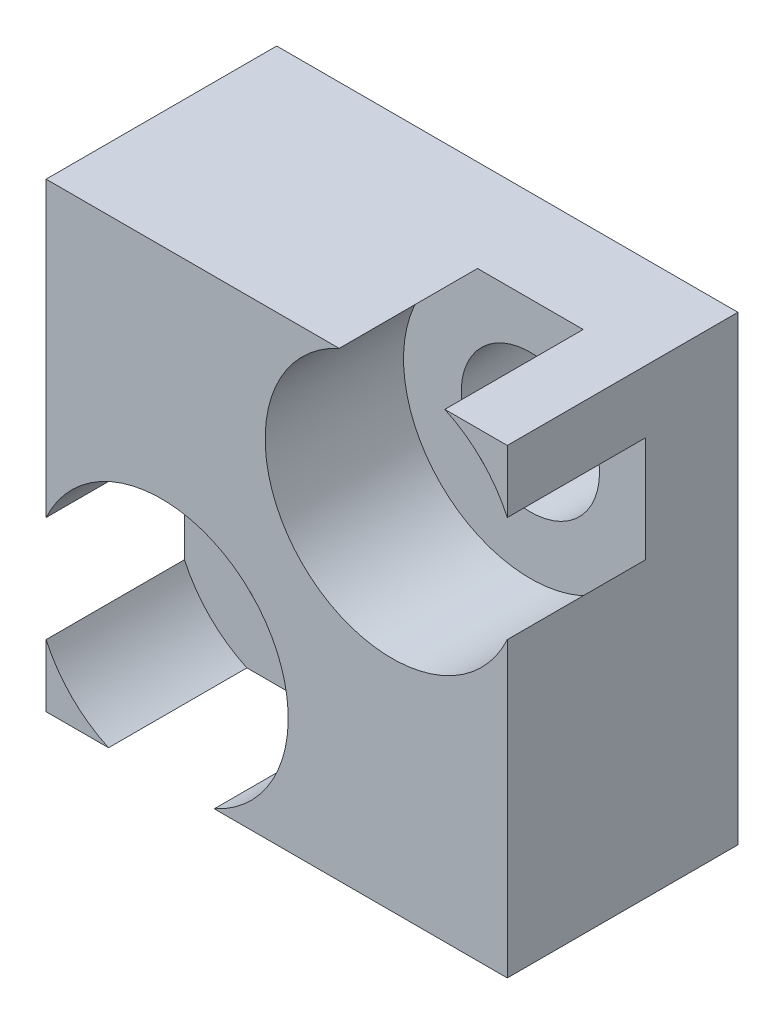
from build123d import *

# Parameters (mm, degrees)
SKETCH_1_W                                  = 20
SKETCH_1_H                                  = 20
BASEBOX_DEPTH                               = 10
HOLE_TWOPOINT_SKETCH_POINTS_EXT_D           = 6
HOLE_TWOPOINT_SKETCH_POINTS_EXT_CBORE_D     = 11
HOLE_TWOPOINT_SKETCH_POINTS_EXT_CBORE_DEPTH = 6


with BuildPart() as part:
    # 草图1 → BaseBox (new body)
    with BuildSketch(Plane.XY):
        with Locations((10, 10)):
            Rectangle(SKETCH_1_W, SKETCH_1_H)
    extrude(amount=BASEBOX_DEPTH)

    # Hole_TwoPoint_sketch_points_ext (through all)
    with Locations(Plane(origin=(15, 15, 10), x_dir=(1, 0, 0), z_dir=(0, 0, 1))):
        with Locations((0, 0), (-10, -10)):
            CounterBoreHole(HOLE_TWOPOINT_SKETCH_POINTS_EXT_D / 2, HOLE_TWOPOINT_SKETCH_POINTS_EXT_CBORE_D / 2, HOLE_TWOPOINT_SKETCH_POINTS_EXT_CBORE_DEPTH)


solid = part.part
